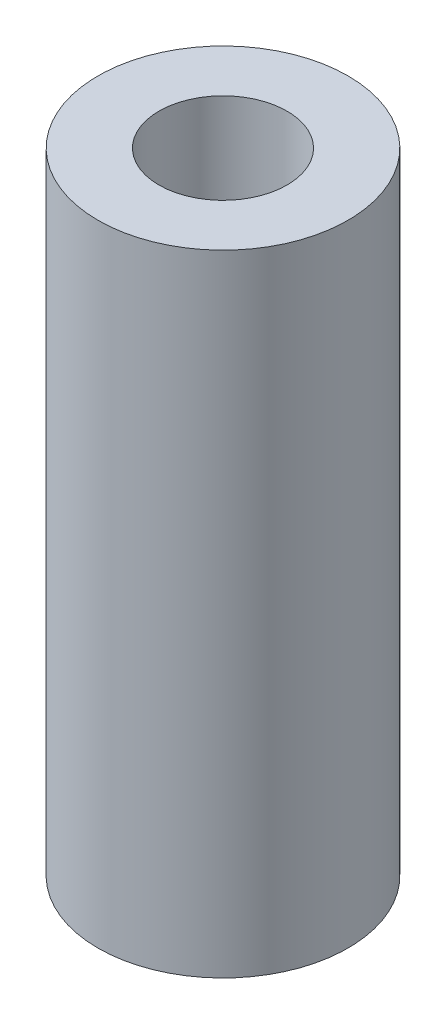
from build123d import *

# Parameters (mm, degrees)
SKETCH1_R           = 3.075
SKETCH1_R_2         = 1.575
BOSS_EXTRUDE1_DEPTH = 15.5


with BuildPart() as part:
    # Sketch1 → Boss-Extrude1 (new body)
    with BuildSketch(Plane(origin=(0, 0, 0), x_dir=(1, 0, 0), z_dir=(0, 1, 0))):
        with Locations(Location((0, 0, 0), (0, 0, 270))):
            Circle(SKETCH1_R)
        with Locations(Location((0, 0, 0), (0, 0, 270))):
            Circle(SKETCH1_R_2, mode=Mode.SUBTRACT)
    extrude(amount=BOSS_EXTRUDE1_DEPTH)


solid = part.part
